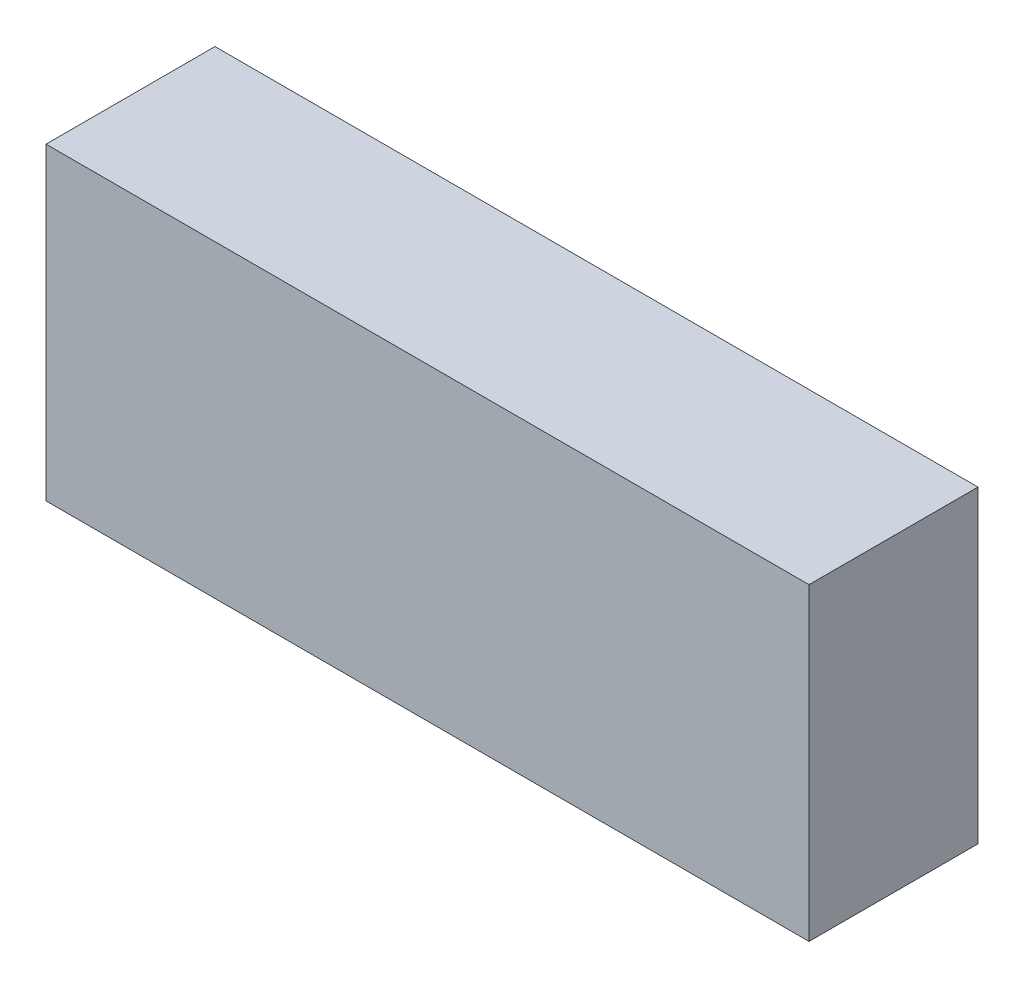
from build123d import *

# Parameters (mm, degrees)
CROQUIS1_W              = 24.2
CROQUIS1_H              = 9.8
SALIENTE_EXTRUIR1_DEPTH = 5.36


with BuildPart() as part:
    # Croquis1 → Saliente-Extruir1 (new body)
    with BuildSketch(Plane.XY):
        Rectangle(CROQUIS1_W, CROQUIS1_H)
    extrude(amount=SALIENTE_EXTRUIR1_DEPTH)


solid = part.part
